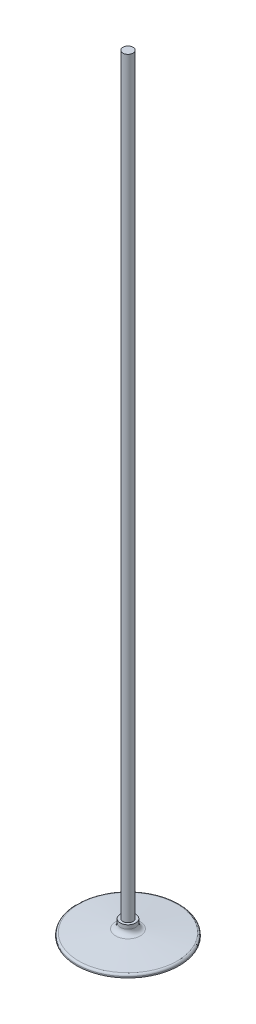
from build123d import *

# Parameters (mm, degrees)
FILLET1_R = 4
FILLET2_R = 10


with BuildPart() as part:
    # Sketch1 → Revolve1 (revolve)
    with BuildSketch(Plane.XY, mode=Mode.PRIVATE) as revolve1_sk:
        Polygon((0, 0), (-100, 0), (-100, 6), (-15, 13.4365364), (-15, 30), (-10, 30), (-10, 1500), (0, 1500), align=None)
    revolve(revolve1_sk.sketch.rotate(Axis((0, 0, 0), (0, -1, 0)), 270), axis=Axis((0, 0, 0), (0, -1, 0)))

    # Fillet1
    fillet1_edges = [part.edges().sort_by_distance(p)[0] for p in [
        (0, 6, -100),
    ]]
    fillet(fillet1_edges, radius=FILLET1_R)

    # Fillet2
    fillet2_edges = [part.edges().sort_by_distance(p)[0] for p in [
        (0, 13.4365364, -15),
    ]]
    fillet(fillet2_edges, radius=FILLET2_R)


solid = part.part
